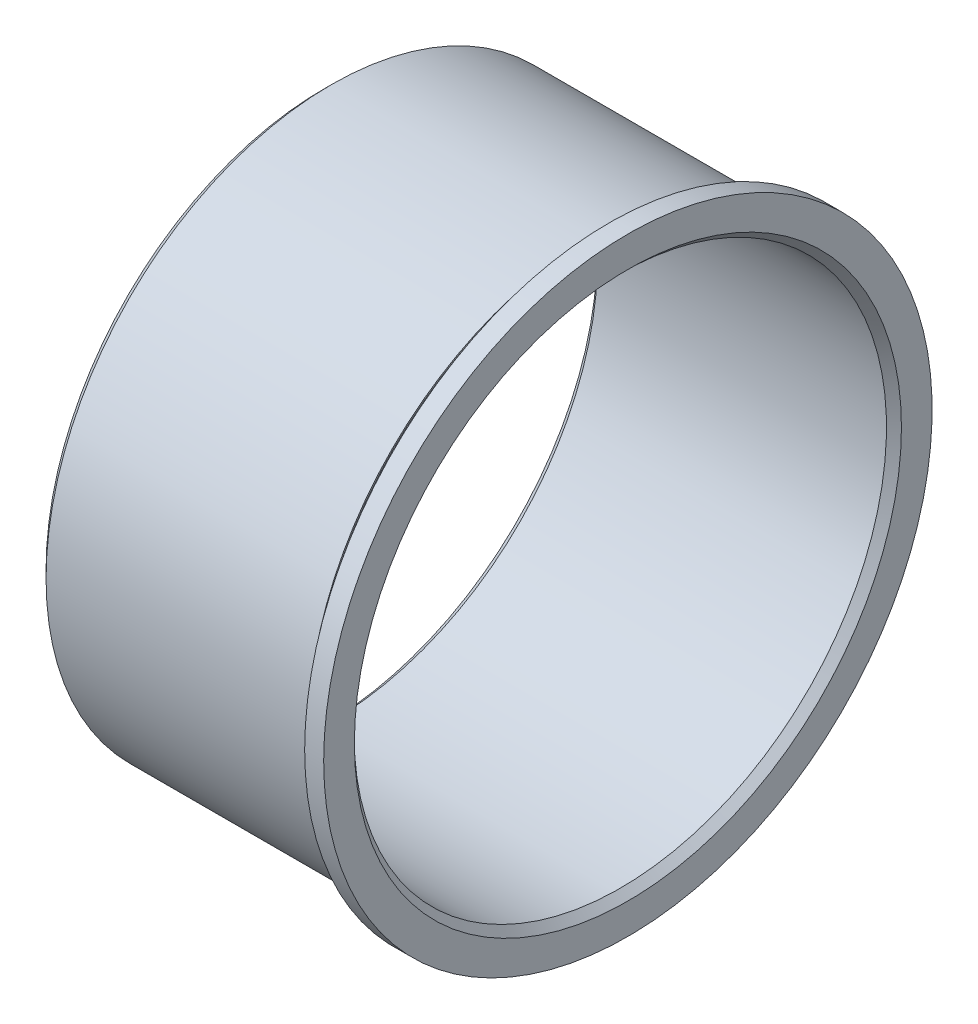
from build123d import *


with BuildPart() as part:
    # Sketch 181 → 旋转1 (revolve)
    with BuildSketch(Plane.XY, mode=Mode.PRIVATE) as revolve_1_sk:
        Polygon((-20, 35.965688775), (-19, 35), (19, 35), (20, 35.965688775), (20, 40), (17.5, 40), (17.5, 37.3), (15.5, 37.3), (15.5, 37.5), (-19, 37.5), (-20, 36.5), align=None)
    revolve(revolve_1_sk.sketch.rotate(Axis((-20, 0, 0), (1, 0, 0)), 90), axis=Axis((-20, 0, 0), (1, 0, 0)))


solid = part.part
